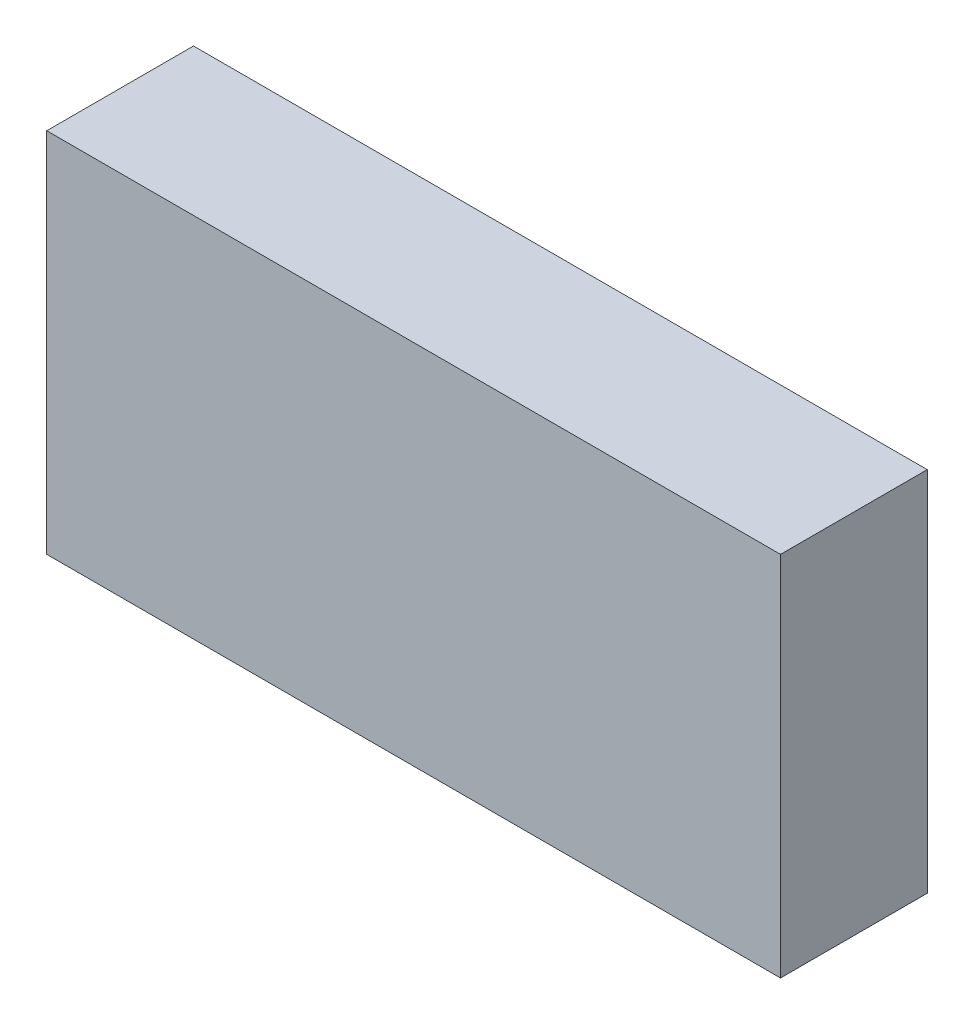
from build123d import *

# Parameters (mm, degrees)
CROQUIS1_W              = 100
CROQUIS1_H              = 50
SALIENTE_EXTRUIR1_DEPTH = 20


with BuildPart() as part:
    # Croquis1 → Saliente-Extruir1 (new body)
    with BuildSketch(Plane.XY):
        Rectangle(CROQUIS1_W, CROQUIS1_H)
    extrude(amount=SALIENTE_EXTRUIR1_DEPTH)


solid = part.part
